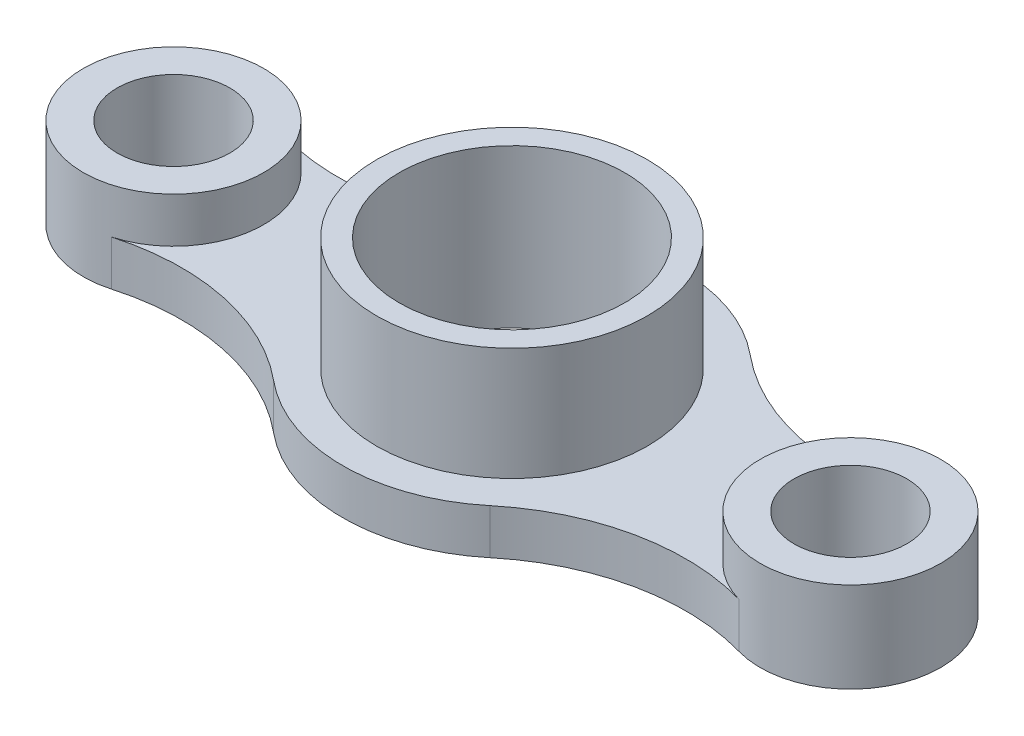
from build123d import *

# Parameters (mm, degrees)
SKETCH1_R           = 60
SKETCH1_R_2         = 25
BOSS_EXTRUDE2_DEPTH = 20
SKETCH1_7_R         = 60
SKETCH1_7_R_2       = 50
BOSS_EXTRUDE3_DEPTH = 70
SKETCH3_R           = 40
SKETCH3_R_2         = 25
BOSS_EXTRUDE4_DEPTH = 20


with BuildPart() as part:
    # Sketch1 → Boss-Extrude2 (new body)
    with BuildSketch(Plane(origin=(0, 0, 0), x_dir=(1, 0, 0), z_dir=(0, 1, 0))):
        with BuildLine():
            ThreePointArc((-139.071428571, 38.478127898), (-190, 0), (-139.071428571, -38.478127898))
            ThreePointArc((-139.071428571, -38.478127898), (-91.104177178, -36.827906099), (-47.892857143, -57.717191847))
            ThreePointArc((-47.892857143, -57.717191847), (0, -75), (47.892857143, -57.717191847))
            ThreePointArc((47.892857143, -57.717191847), (91.104177178, -36.827906099), (139.071428571, -38.478127898))
            ThreePointArc((139.071428571, -38.478127898), (190, 0), (139.071428571, 38.478127898))
            ThreePointArc((139.071428571, 38.478127898), (91.104177178, 36.827906099), (47.892857143, 57.717191847))
            ThreePointArc((47.892857143, 57.717191847), (0, 75), (-47.892857143, 57.717191847))
            ThreePointArc((-47.892857143, 57.717191847), (-91.104177178, 36.827906099), (-139.071428571, 38.478127898))
        make_face()
        Circle(SKETCH1_R, mode=Mode.SUBTRACT)
        with Locations((-150, 0)):
            Circle(SKETCH1_R_2, mode=Mode.SUBTRACT)
        with Locations((150, 0)):
            Circle(SKETCH1_R_2, mode=Mode.SUBTRACT)
    extrude(amount=BOSS_EXTRUDE2_DEPTH)

    # Sketch1<7> → Boss-Extrude3 (add)
    with BuildSketch(Plane(origin=(0, 0, 0), x_dir=(1, 0, 0), z_dir=(0, 1, 0))):
        Circle(SKETCH1_7_R)
        Circle(SKETCH1_7_R_2, mode=Mode.SUBTRACT)
    extrude(amount=BOSS_EXTRUDE3_DEPTH)

    # Sketch3 → Boss-Extrude4 (add)
    with BuildSketch(Plane(origin=(0, 20, 0), x_dir=(1, 0, 0), z_dir=(0, 1, 0))):
        with Locations((-150, 0)):
            Circle(SKETCH3_R)
        with Locations((-150, 0)):
            Circle(SKETCH3_R_2, mode=Mode.SUBTRACT)
    boss_extrude4 = extrude(amount=BOSS_EXTRUDE4_DEPTH)

    # Mirror1: Boss-Extrude4 across plane
    add(boss_extrude4.mirror(Plane(origin=(0, 0, 0), x_dir=(0, 0, 1), z_dir=(1, 0, 0))))


solid = part.part
